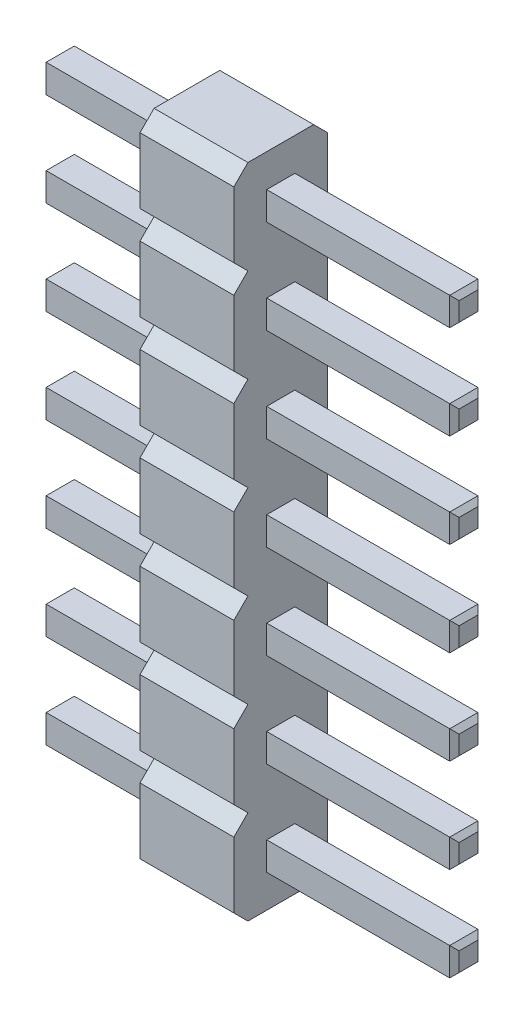
from build123d import *

# Parameters (mm, degrees)
PLASTIC_DEPTH   = 2
SKETCH2_W       = 8.8
SKETCH2_H       = 0.6
CONTACT_DEPTH   = 0.3
CHAMFER1_SIZE   = 0.1
LPATTERN1_COUNT = 7
LPATTERN1_PITCH = 2


with BuildPart() as part:
    # Sketch1 → Plastic (new body)
    with BuildSketch(Plane(origin=(0, 0, 0), x_dir=(0, 0, -1), z_dir=(1, 0, 0))):
        Polygon((-1.7, 1), (-0.3, 1), (0, 0.7), (0, -0.7), (-0.3, -1), (-1.7, -1), (-2, -0.7), (-2, 0.7), align=None)
    extrude(amount=PLASTIC_DEPTH)

    # Sketch2 → Contact (add, symmetric)
    with BuildSketch(Plane(origin=(0, 0, 0), x_dir=(1, 0, 0), z_dir=(0, 1, 0))):
        with Locations((1.6, -1)):
            Rectangle(SKETCH2_W, SKETCH2_H)
    extrude(amount=CONTACT_DEPTH, both=True)

    # Chamfer1
    chamfer1_edges = [part.edges().sort_by_distance(p)[0] for p in [
        (6, 0, 0.7),
        (6, 0.3, 1),
        (-2.8, 0, 1.3),
        (6, -0.3, 1),
        (6, 0, 1.3),
        (-2.8, -0.3, 1),
        (-2.8, 0, 0.7),
        (-2.8, 0.3, 1),
    ]]
    chamfer(chamfer1_edges, length=CHAMFER1_SIZE)

    # LPattern1: part ×7


with BuildPart() as part_1:
    add(part.part)
    with Locations(*[(0, i * LPATTERN1_PITCH, 0) for i in range(1, LPATTERN1_COUNT)]):
        add(part.part)


solid = part_1.part
